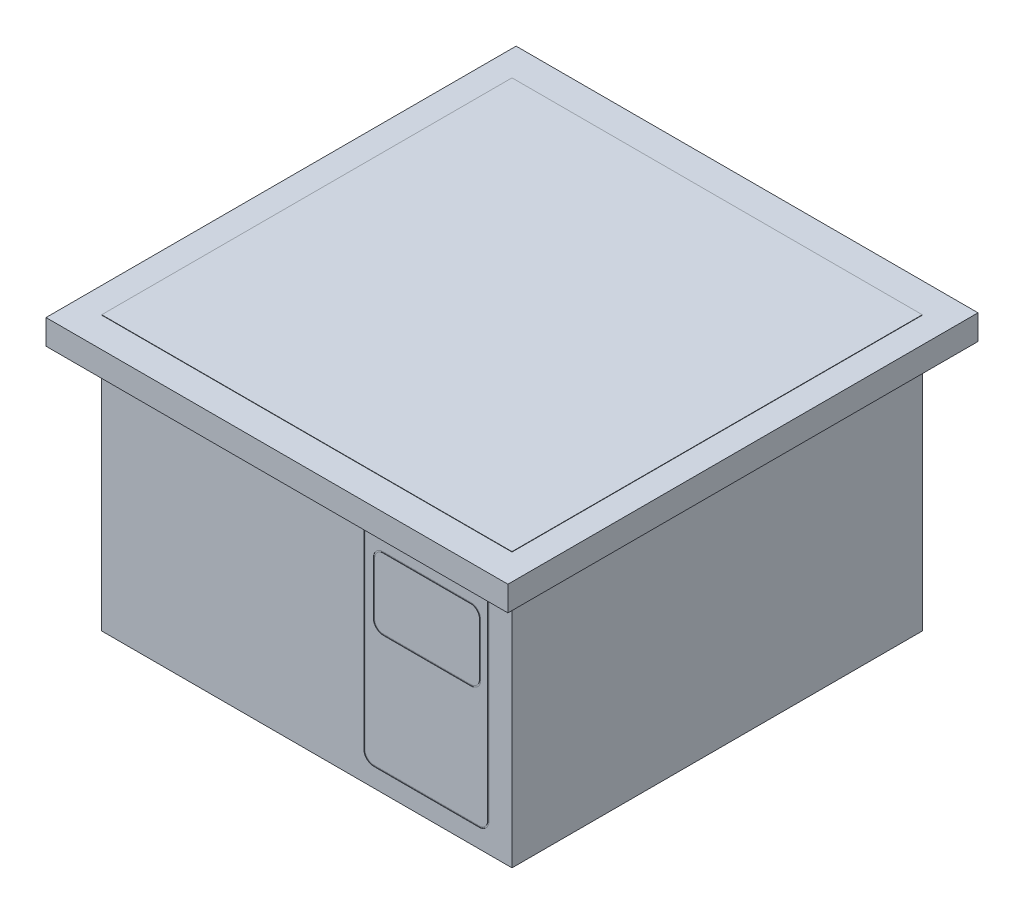
from build123d import *

# Parameters (mm, degrees)
CROQUIS1_W              = 3300
CROQUIS1_H              = 3300
CROQUIS1_W_2            = 3000
CROQUIS1_H_2            = 3000
SALIENTE_EXTRUIR1_DEPTH = 2000
CROQUIS2_W              = 3715.107812374
CROQUIS2_H              = 3780.923334612
CROQUIS2_W_2            = 3300
CROQUIS2_H_2            = 3300
SALIENTE_EXTRUIR2_DEPTH = 200
CORTAR_EXTRUIR1_DEPTH   = 3
CORTAR_EXTRUIR2_DEPTH   = 3
CROQUIS5_W              = 3300
CROQUIS5_H              = 3300
SALIENTE_EXTRUIR3_DEPTH = 3


with BuildPart() as part:
    # Croquis1 → Saliente-Extruir1 (new body)
    with BuildSketch(Plane(origin=(0, 0, 0), x_dir=(1, 0, 0), z_dir=(0, 1, 0))):
        Rectangle(CROQUIS1_W, CROQUIS1_H)
        Rectangle(CROQUIS1_W_2, CROQUIS1_H_2, mode=Mode.SUBTRACT)
    extrude(amount=SALIENTE_EXTRUIR1_DEPTH)

    # Croquis3 → Cortar-Extruir1 (cut)
    with BuildSketch(Plane.XY.offset(1650)):
        with BuildLine():
            Line((458.693356997, 1745.135347933), (458.693356997, 231.101371952))
            ThreePointArc((458.693356997, 231.101371952), (482.124814502, 174.532829457), (538.693356997, 151.101371952))
            Line((538.693356997, 151.101371952), (1384.461320744, 151.101371952))
            ThreePointArc((1384.461320744, 151.101371952), (1441.029863239, 174.532829457), (1464.461320744, 231.101371952))
            Line((1464.461320744, 231.101371952), (1464.461320744, 1745.135347933))
            ThreePointArc((1464.461320744, 1745.135347933), (1441.029863239, 1801.703890428), (1384.461320744, 1825.135347933))
            Line((1384.461320744, 1825.135347933), (538.693356997, 1825.135347933))
            ThreePointArc((538.693356997, 1825.135347933), (482.124814502, 1801.703890428), (458.693356997, 1745.135347933))
        make_face()
        with BuildLine():
            Line((538.693356997, 1815.135347933), (1384.461320744, 1815.135347933))
            ThreePointArc((1384.461320744, 1815.135347933), (1433.958795427, 1794.632822616), (1454.461320744, 1745.135347933))
            Line((1454.461320744, 1745.135347933), (1454.461320744, 231.101371952))
            ThreePointArc((1454.461320744, 231.101371952), (1433.958795427, 181.603897269), (1384.461320744, 161.101371952))
            Line((1384.461320744, 161.101371952), (538.693356997, 161.101371952))
            ThreePointArc((538.693356997, 161.101371952), (489.195882313, 181.603897269), (468.693356997, 231.101371952))
            Line((468.693356997, 231.101371952), (468.693356997, 1745.135347933))
            ThreePointArc((468.693356997, 1745.135347933), (489.195882313, 1794.632822616), (538.693356997, 1815.135347933))
        make_face(mode=Mode.SUBTRACT)
    extrude(amount=-CORTAR_EXTRUIR1_DEPTH, mode=Mode.SUBTRACT)

    # Croquis4 → Cortar-Extruir2 (cut)
    with BuildSketch(Plane.XY.offset(1650)):
        with BuildLine():
            Line((535.242823134, 1604.170281482), (535.242823134, 1181.915657145))
            ThreePointArc((535.242823134, 1181.915657145), (558.674280639, 1125.34711465), (615.242823134, 1101.915657145))
            Line((615.242823134, 1101.915657145), (1318.624759638, 1101.915657145))
            ThreePointArc((1318.624759638, 1101.915657145), (1375.193302133, 1125.34711465), (1398.624759638, 1181.915657145))
            Line((1398.624759638, 1181.915657145), (1398.624759638, 1604.170281482))
            ThreePointArc((1398.624759638, 1604.170281482), (1375.193302133, 1660.738823977), (1318.624759638, 1684.170281482))
            Line((1318.624759638, 1684.170281482), (615.242823134, 1684.170281482))
            ThreePointArc((615.242823134, 1684.170281482), (558.674280639, 1660.738823977), (535.242823134, 1604.170281482))
        make_face()
        with BuildLine():
            Line((615.242823134, 1674.170281482), (1318.624759638, 1674.170281482))
            ThreePointArc((1318.624759638, 1674.170281482), (1368.122234322, 1653.667756165), (1388.624759638, 1604.170281482))
            Line((1388.624759638, 1604.170281482), (1388.624759638, 1181.915657145))
            ThreePointArc((1388.624759638, 1181.915657145), (1368.122234322, 1132.418182462), (1318.624759638, 1111.915657145))
            Line((1318.624759638, 1111.915657145), (615.242823134, 1111.915657145))
            ThreePointArc((615.242823134, 1111.915657145), (565.74534845, 1132.418182462), (545.242823134, 1181.915657145))
            Line((545.242823134, 1181.915657145), (545.242823134, 1604.170281482))
            ThreePointArc((545.242823134, 1604.170281482), (565.74534845, 1653.667756165), (615.242823134, 1674.170281482))
        make_face(mode=Mode.SUBTRACT)
    extrude(amount=-CORTAR_EXTRUIR2_DEPTH, mode=Mode.SUBTRACT)


with BuildPart() as body_2:
    # Croquis2 → Saliente-Extruir2 (new body)
    with BuildSketch(Plane(origin=(0, 2000, 0), x_dir=(1, 0, 0), z_dir=(0, 1, 0))):
        Rectangle(CROQUIS2_W, CROQUIS2_H)
        Rectangle(CROQUIS2_W_2, CROQUIS2_H_2, mode=Mode.SUBTRACT)
    extrude(amount=SALIENTE_EXTRUIR2_DEPTH)


with BuildPart() as body_3:
    # Croquis5 → Saliente-Extruir3 (new body)
    with BuildSketch(Plane(origin=(0, 2200, 0), x_dir=(1, 0, 0), z_dir=(0, 1, 0))):
        Rectangle(CROQUIS5_W, CROQUIS5_H)
    extrude(amount=SALIENTE_EXTRUIR3_DEPTH)


solid = Compound([part.part, body_2.part, body_3.part])
